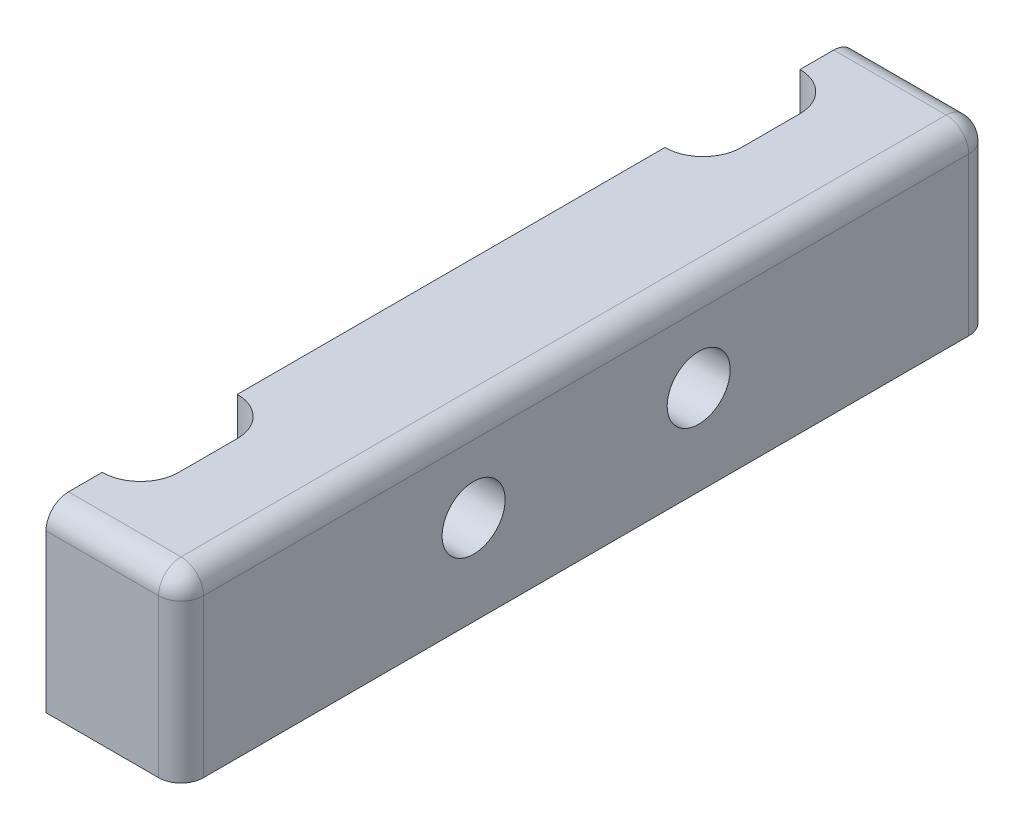
from build123d import *

# Parameters (mm, degrees)
BASE_DEPTH           = 8
SKETCH2_R            = 1.4
SCREW_HOLES_DEPTH    = 21.591260282
F_1MM_EDGE_FILLETS_R = 1


with BuildPart() as part:
    # Sketch1 → Base (new body)
    with BuildSketch(Plane(origin=(0, 0, 0), x_dir=(1, 0, 0), z_dir=(0, 1, 0))):
        with BuildLine():
            Line((-6, 18), (-6, 15.5))
            ThreePointArc((-6, 15.5), (-4.797918472, 15.002081528), (-4.3, 13.8))
            Line((-4.3, 13.8), (-4.3, 11.2))
            ThreePointArc((-4.3, 11.2), (-4.797918472, 9.997918472), (-6, 9.5))
            Line((-6, 9.5), (-6, -9.5))
            ThreePointArc((-6, -9.5), (-4.797918472, -9.997918472), (-4.3, -11.2))
            Line((-4.3, -11.2), (-4.3, -13.8))
            ThreePointArc((-4.3, -13.8), (-4.797918472, -15.002081528), (-6, -15.5))
            Line((-6, -15.5), (-6, -18))
            Line((-6, -18), (0, -18))
            Line((0, -18), (0, 18))
            Line((0, 18), (-6, 18))
        make_face()
    extrude(amount=BASE_DEPTH)

    # Sketch2 → Screw Holes (cut, through all)
    with BuildSketch(Plane.ZY.offset(6)):
        with Locations((-5, 4)):
            Circle(SKETCH2_R)
        with Locations(Location((5, 4, 0), (0, 0, 180))):
            Circle(SKETCH2_R)
    extrude(amount=-SCREW_HOLES_DEPTH, mode=Mode.SUBTRACT)

    # 1mm Edge Fillets
    f_1mm_edge_fillets_edges = [part.edges().sort_by_distance(p)[0] for p in [
        (0, 4, -18),
        (0, 4, 18),
        (-3, 8, 18),
        (0, 8, 0),
        (-3, 8, -18),
    ]]
    fillet(f_1mm_edge_fillets_edges, radius=F_1MM_EDGE_FILLETS_R)


solid = part.part
